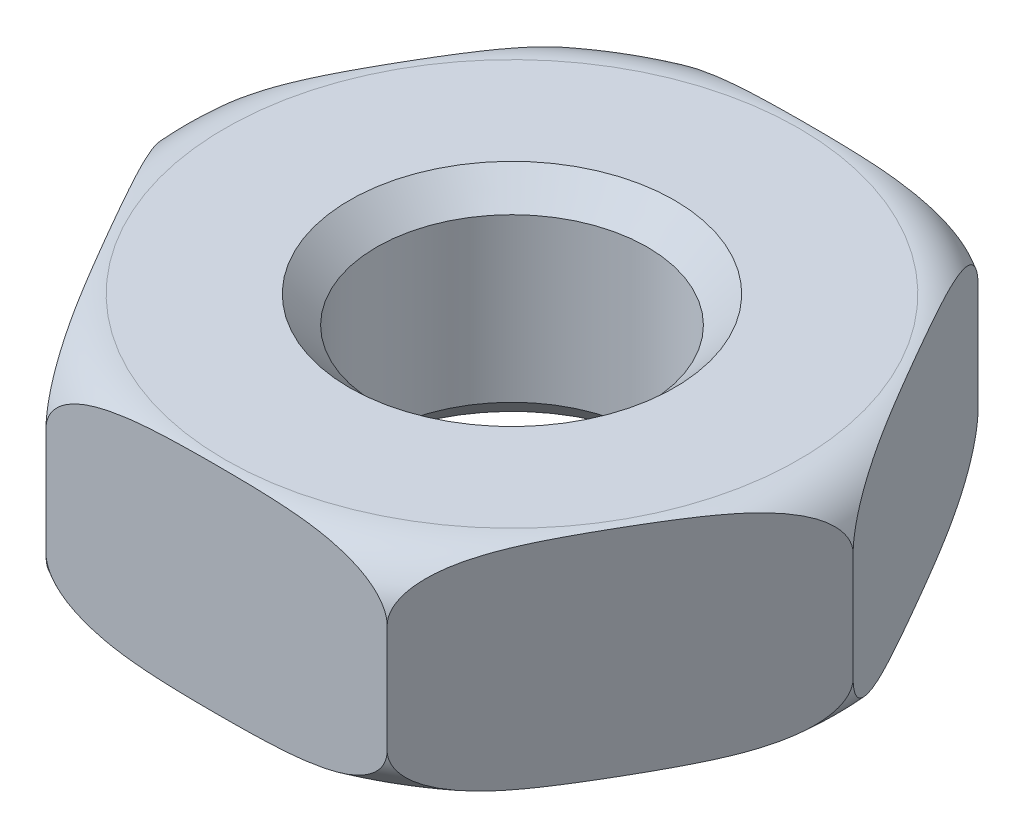
from build123d import *

# Parameters (mm, degrees)
SKETCH1_R           = 1.25
BOSS_EXTRUDE1_DEPTH = 1
CHAMFER1_SIZE       = 0.25


with BuildPart() as part:
    # Sketch1 → Boss-Extrude1 (new, symmetric)
    with BuildSketch(Plane(origin=(0, 0, 0), x_dir=(1, 0, 0), z_dir=(0, 1, 0))):
        Polygon((-1.575, 2.727980022), (-3.15, 0), (-1.575, -2.727980022), (1.575, -2.727980022), (3.15, 0), (1.575, 2.727980022), align=None)
        with Locations(Location((0, 0, 0), (0, 0, 270))):
            Circle(SKETCH1_R, mode=Mode.SUBTRACT)
    extrude(amount=BOSS_EXTRUDE1_DEPTH, both=True)

    # Chamfer1
    chamfer1_edges = [part.edges().sort_by_distance(p)[0] for p in [
        (0, -1, -1.25),
        (0, 1, -1.25),
    ]]
    chamfer(chamfer1_edges, length=CHAMFER1_SIZE)

    # Sketch3 → Cut-Revolve1 (revolve, cut)
    with BuildSketch(Plane.XY, mode=Mode.PRIVATE) as cut_revolve1_sk:
        with BuildLine():
            Line((2.65, 1), (3.15, 1))
            Line((3.15, 1), (3.15, 0.5))
            ThreePointArc((3.15, 0.5), (3.003553391, 0.853553391), (2.65, 1))
        make_face()
    cut_revolve1 = revolve(cut_revolve1_sk.sketch.rotate(Axis((0, 1, 0), (0, -1, 0)), 90), axis=Axis((0, 1, 0), (0, -1, 0)), mode=Mode.SUBTRACT)

    # Mirror1: Cut-Revolve1 across plane
    add(cut_revolve1.mirror(Plane.ZX), mode=Mode.SUBTRACT)


solid = part.part
